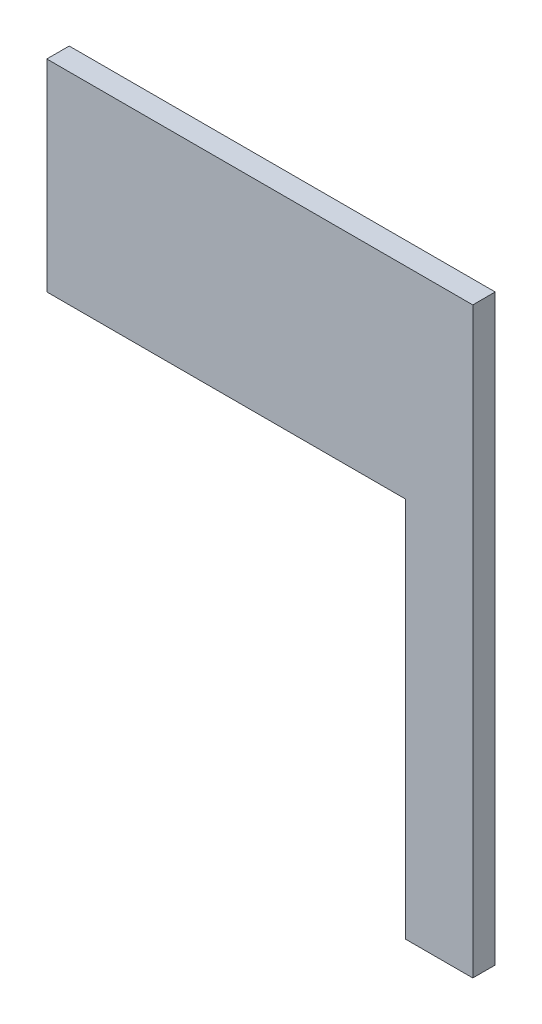
from build123d import *

# Parameters (mm, degrees)
BOSS_EXTRUDE1_DEPTH = 5


with BuildPart() as part:
    # Sketch1 → Boss-Extrude1 (new body)
    with BuildSketch(Plane.XY):
        Polygon((0, 0), (80, 0), (80, -85), (95, -85), (95, 45), (85, 45), (0, 45), align=None)
    extrude(amount=BOSS_EXTRUDE1_DEPTH)


solid = part.part
